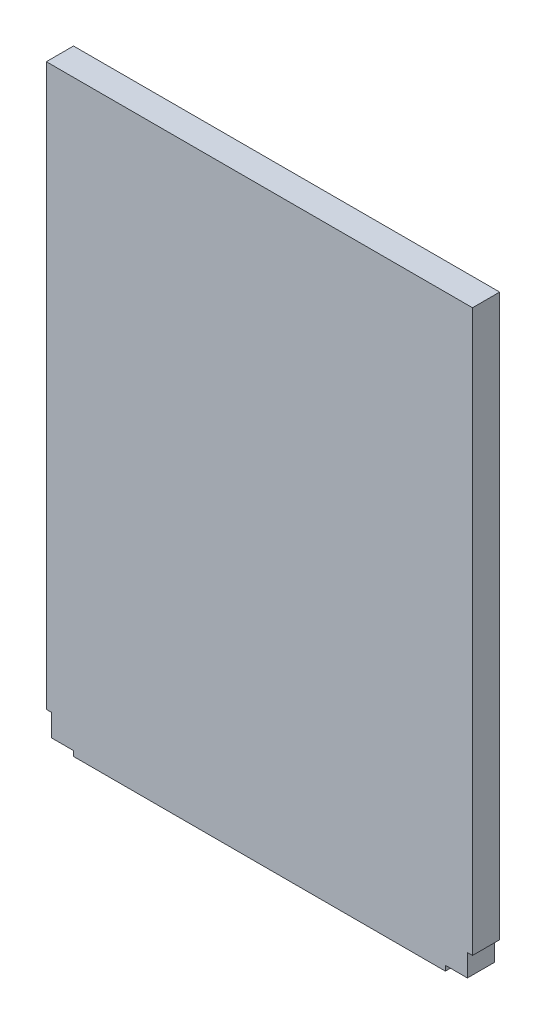
from build123d import *

# Parameters (mm, degrees)
CROQUIS1_W              = 797.1
CROQUIS1_H              = 1100
SALIENTE_EXTRUIR1_DEPTH = 50.8
CORTAR_EXTRUIR1_DEPTH   = 51


with BuildPart() as part:
    # Croquis1 → Saliente-Extruir1 (new body)
    with BuildSketch(Plane.XY):
        with Locations((398.55, -550)):
            Rectangle(CROQUIS1_W, CROQUIS1_H)
    extrude(amount=SALIENTE_EXTRUIR1_DEPTH)

    # Croquis2 → Cortar-Extruir1 (cut)
    with BuildSketch(Plane.XY.offset(50.8)):
        Polygon((0, -1049.2), (9.525, -1049.2), (9.525, -1090.475), (50.8, -1090.475), (50.8, -1100), (0, -1100), align=None)
        Polygon((797.1, -1100), (797.1, -1049.2), (787.575, -1049.2), (787.575, -1090.475), (746.3, -1090.475), (746.3, -1100), align=None)
    extrude(amount=-CORTAR_EXTRUIR1_DEPTH, mode=Mode.SUBTRACT)


solid = part.part
